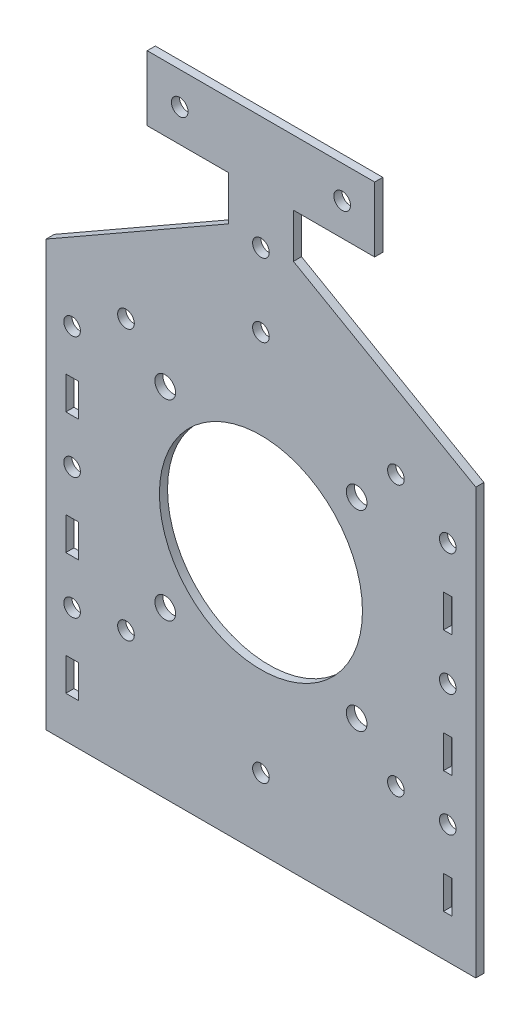
from build123d import *

# Parameters (mm, degrees)
SKETCH_1_R      = 2.55
SKETCH_1_R_2    = 25
SKETCH_1_R_3    = 2.05
SKETCH_1_W      = 2.1
SKETCH_1_H      = 8.1
SKETCH_1_W_2    = 3.1
EXTRUDE_1_DEPTH = 2


with BuildPart() as part:
    # 草图1 → 凸台-拉伸1 (new body)
    with BuildSketch(Plane.XY):
        Polygon((-52.9, 53.883164809), (-52.9, -50.79), (52.9, -50.79), (52.9, 53.883164809), (8, 79.569735886), (8, 90.5), (28, 90.5), (28, 106.5), (-28, 106.5), (-28, 90.5), (-8, 90.5), (-8, 79.569735886), align=None)
        with Locations((-23.57, 37.07)):
            Circle(SKETCH_1_R, mode=Mode.SUBTRACT)
        with Locations((-23.57, -10.07)):
            Circle(SKETCH_1_R, mode=Mode.SUBTRACT)
        with Locations((23.57, -10.07)):
            Circle(SKETCH_1_R, mode=Mode.SUBTRACT)
        with Locations((23.57, 37.07)):
            Circle(SKETCH_1_R, mode=Mode.SUBTRACT)
        with Locations((0, 13.5)):
            Circle(SKETCH_1_R_2, mode=Mode.SUBTRACT)
        with Locations((0, 60.5)):
            Circle(SKETCH_1_R_3, mode=Mode.SUBTRACT)
        with Locations((33.234018716, 46.734018716)):
            Circle(SKETCH_1_R_3, mode=Mode.SUBTRACT)
        with Locations((33.234018716, -19.734018716)):
            Circle(SKETCH_1_R_3, mode=Mode.SUBTRACT)
        with Locations((0, -33.5)):
            Circle(SKETCH_1_R_3, mode=Mode.SUBTRACT)
        with Locations((-33.234018716, -19.734018716)):
            Circle(SKETCH_1_R_3, mode=Mode.SUBTRACT)
        with Locations((-33.234018716, 46.734018716)):
            Circle(SKETCH_1_R_3, mode=Mode.SUBTRACT)
        with Locations((0, 78.5)):
            Circle(SKETCH_1_R_3, mode=Mode.SUBTRACT)
        with Locations((-20, 98.5)):
            Circle(SKETCH_1_R_3, mode=Mode.SUBTRACT)
        with Locations((20, 98.5)):
            Circle(SKETCH_1_R_3, mode=Mode.SUBTRACT)
        with Locations((46, 8.5)):
            Circle(SKETCH_1_R_3, mode=Mode.SUBTRACT)
        with Locations((46, -21.5)):
            Circle(SKETCH_1_R_3, mode=Mode.SUBTRACT)
        with Locations((46, 38.5)):
            Circle(SKETCH_1_R_3, mode=Mode.SUBTRACT)
        with Locations((-46.5, -21.5)):
            Circle(SKETCH_1_R_3, mode=Mode.SUBTRACT)
        with Locations((-46.5, 8.5)):
            Circle(SKETCH_1_R_3, mode=Mode.SUBTRACT)
        with Locations((-46.5, 38.5)):
            Circle(SKETCH_1_R_3, mode=Mode.SUBTRACT)
        with Locations((46, 23.5)):
            Rectangle(SKETCH_1_W, SKETCH_1_H, mode=Mode.SUBTRACT)
        with Locations((46, -6.5)):
            Rectangle(SKETCH_1_W, SKETCH_1_H, mode=Mode.SUBTRACT)
        with Locations((46, -36.5)):
            Rectangle(SKETCH_1_W, SKETCH_1_H, mode=Mode.SUBTRACT)
        with Locations((-46.5, 23.5)):
            Rectangle(SKETCH_1_W_2, SKETCH_1_H, mode=Mode.SUBTRACT)
        with Locations((-46.5, -6.5)):
            Rectangle(SKETCH_1_W_2, SKETCH_1_H, mode=Mode.SUBTRACT)
        with Locations((-46.5, -36.5)):
            Rectangle(SKETCH_1_W_2, SKETCH_1_H, mode=Mode.SUBTRACT)
    extrude(amount=EXTRUDE_1_DEPTH)


solid = part.part
